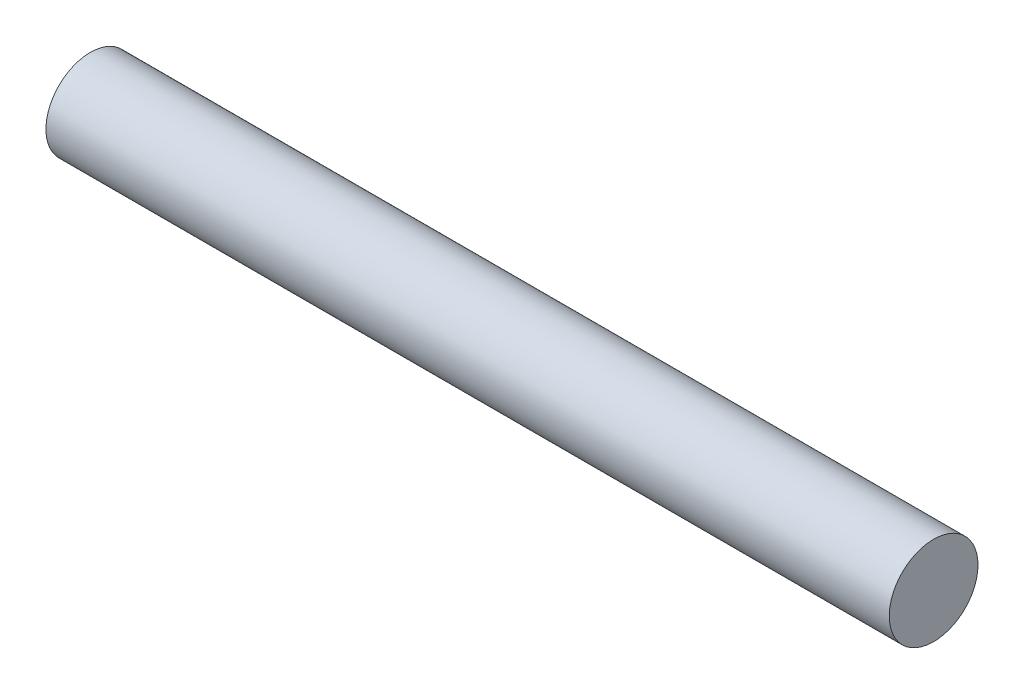
from build123d import *

# Parameters (mm, degrees)
SKETCH1_R           = 20
BOSS_EXTRUDE1_DEPTH = 380


with BuildPart() as part:
    # Sketch1 → Boss-Extrude1 (new body)
    with BuildSketch(Plane(origin=(0, 0, 0), x_dir=(0, 0, -1), z_dir=(1, 0, 0))):
        Circle(SKETCH1_R)
    extrude(amount=BOSS_EXTRUDE1_DEPTH)


solid = part.part
